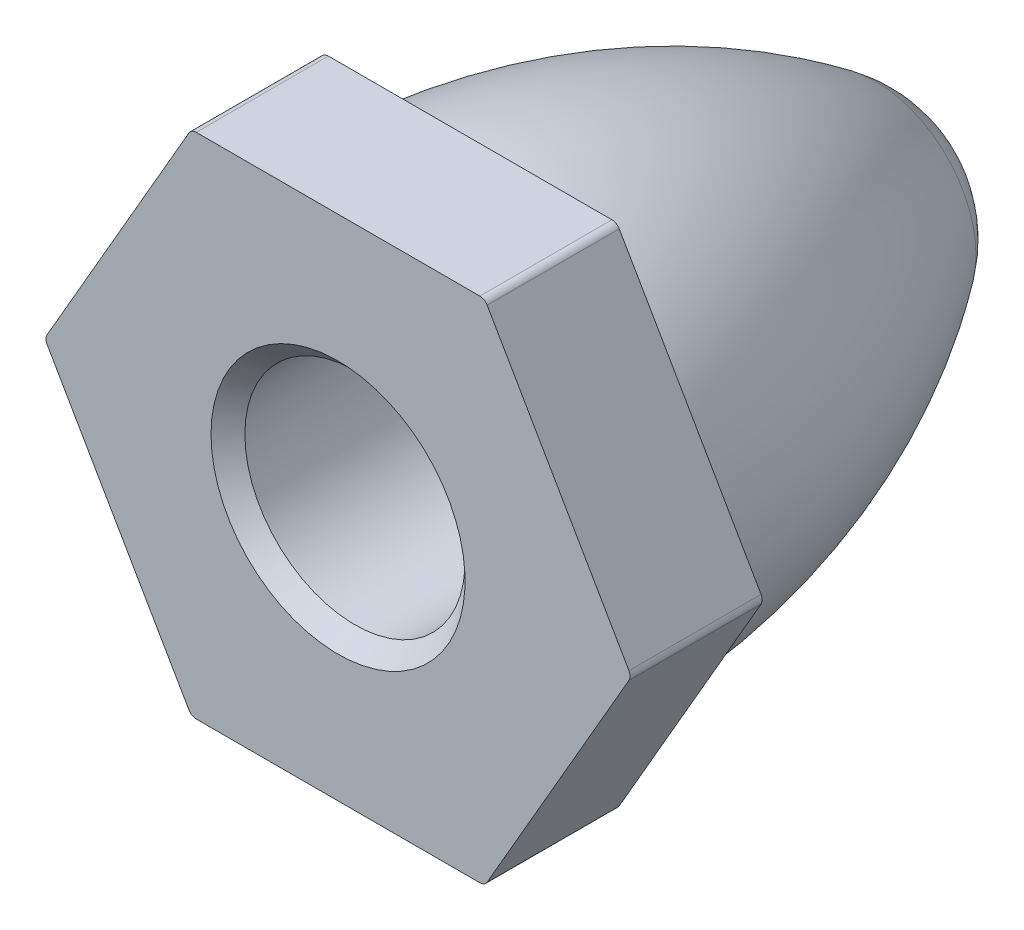
from build123d import *

# Parameters (mm, degrees)
ESQUISSE2_R      = 2.6
EXTRUSION1_DEPTH = 3.12
EXTRUSION2_START = -10
ESQUISSE4_R      = 2.6
EXTRUSION2_DEPTH = 10
CONG_1_R         = 0.2
CHANFREIN1_SIZE  = 0.4


with BuildPart() as part:
    # Esquisse2 → Extrusion1 (new body)
    with BuildSketch(Plane.XY):
        Polygon((6.92820323, 0), (3.464101615, 6), (-3.464101615, 6), (-6.92820323, 0), (-3.464101615, -6), (3.464101615, -6), align=None)
        with Locations(Location((0, 0, 0), (0, 0, 180))):
            Circle(ESQUISSE2_R, mode=Mode.SUBTRACT)
    extrude(amount=EXTRUSION1_DEPTH)

    # Esquisse3 → Révolution1 (revolve)
    with BuildSketch(Plane(origin=(0, 0, 0), x_dir=(1, 0, 0), z_dir=(0, 1, 0))):
        with BuildLine():
            Line((5.5, 0), (0, 0))
            Line((0, 0), (0, 10.78))
            ThreePointArc((0, 10.78), (1.326705119, 10.462857182), (2.366555702, 9.58))
            ThreePointArc((2.366555702, 9.58), (4.696738417, 5.039714108), (5.5, 0))
        make_face()
    revolve(axis=Axis((0, 0, 0), (0, 0, -1)))

    # Esquisse4 → Extrusion2 (cut)
    with BuildSketch(Plane.XY.offset(3.12).offset(EXTRUSION2_START)):
        with Locations(Location((0, 0, 0), (0, 0, 180))):
            Circle(ESQUISSE4_R)
    extrude(amount=EXTRUSION2_DEPTH, mode=Mode.SUBTRACT)

    # Congé1
    cong_1_edges = [part.edges().sort_by_distance(p)[0] for p in [
        (-3.464101615, -6, 1.56),
        (-6.92820323, 0, 1.56),
        (-3.464101615, 6, 1.56),
        (3.464101615, 6, 1.56),
        (6.92820323, 0, 1.56),
        (3.464101615, -6, 1.56),
    ]]
    fillet(cong_1_edges, radius=CONG_1_R)

    # Chanfrein1
    chanfrein1_edges = [part.edges().sort_by_distance(p)[0] for p in [
        (2.6, 0, 3.12),
    ]]
    chamfer(chanfrein1_edges, length=CHANFREIN1_SIZE)


solid = part.part
